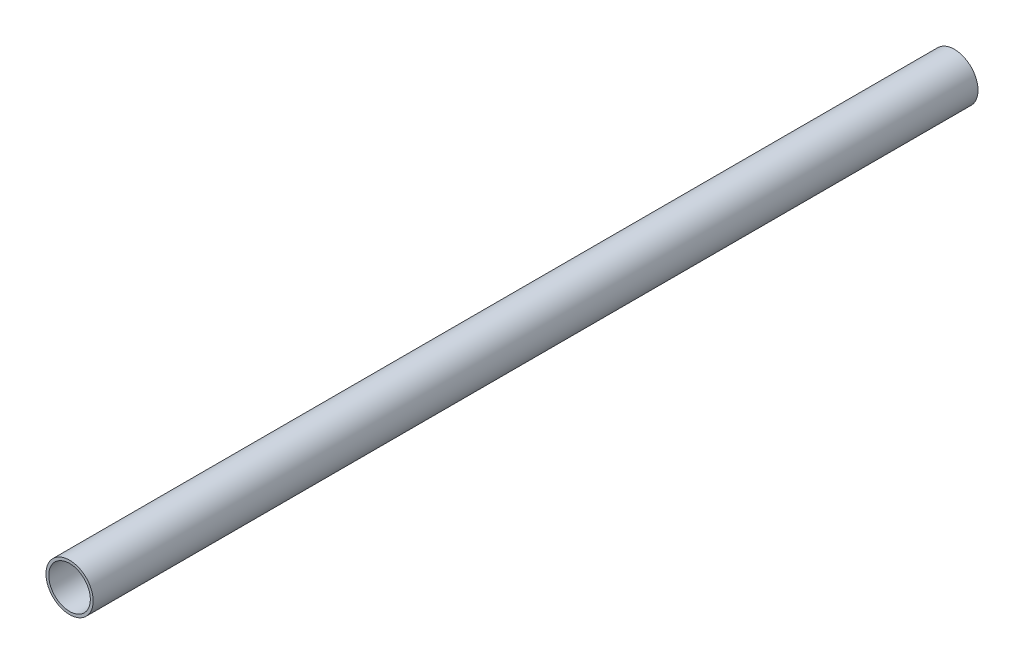
from build123d import *

# Parameters (mm, degrees)
PIPESKETCH_R    = 16
PIPESKETCH_R_2  = 14.1
EXTRUSION_DEPTH = 600


with BuildPart() as part:
    # PipeSketch → Extrusion (new body)
    with BuildSketch(Plane.XY):
        Circle(PIPESKETCH_R)
        Circle(PIPESKETCH_R_2, mode=Mode.SUBTRACT)
    extrude(amount=EXTRUSION_DEPTH)


solid = part.part
